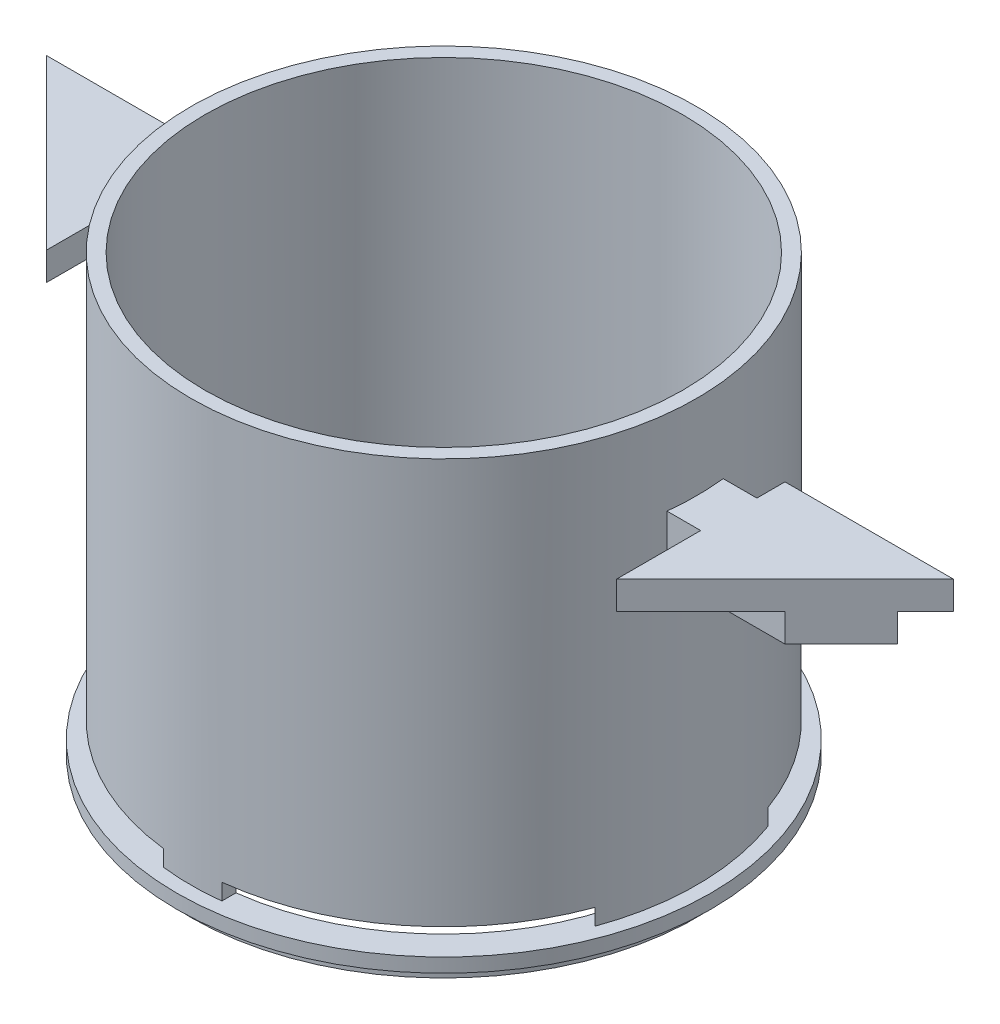
from build123d import *

# Parameters (mm, degrees)
SKETCH1_R               = 57.15
BOSS_EXTRUDE1_DEPTH     = 101.6
SKETCH2_R               = 53.975
CUT_EXTRUDE1_DEPTH      = 130.826056707
CUT_EXTRUDE4_DEPTH      = 130.826056707
CUT_EXTRUDE4_DEPTH_BACK = 130.826056707
SKETCH6_W               = 47.117
SKETCH6_H               = 3.683
BOSS_EXTRUDE7_START     = 3.175
SKETCH10_R              = 60.325
SKETCH10_R_2            = 57.15
BOSS_EXTRUDE7_DEPTH     = 3.175
BOSS_EXTRUDE6_START     = 12.7
BOSS_EXTRUDE6_DEPTH     = 12.7
BOSS_EXTRUDE8_DEPTH     = 6.35


with BuildPart() as part:
    # Sketch1 → Boss-Extrude1 (new body)
    with BuildSketch(Plane(origin=(0, 0, 0), x_dir=(1, 0, 0), z_dir=(0, 1, 0))):
        with Locations(Location((0, 0, 0), (0, 0, 270))):
            Circle(SKETCH1_R)
    extrude(amount=BOSS_EXTRUDE1_DEPTH)

    # Sketch2 → Cut-Extrude1 (cut, through all)
    with BuildSketch(Plane(origin=(0, 101.6, 0), x_dir=(1, 0, 0), z_dir=(0, 1, 0))):
        with Locations(Location((0, 0, 0), (0, 0, 270))):
            Circle(SKETCH2_R)
    extrude(amount=-CUT_EXTRUDE1_DEPTH, mode=Mode.SUBTRACT)

    # Sketch6 → Cut-Extrude4 (cut, two sides: drawn at the far end of the back side and taken through both)
    with BuildSketch(Plane.XY.offset(-CUT_EXTRUDE4_DEPTH_BACK)):
        with Locations((-30.1625, 8.1915)):
            Rectangle(SKETCH6_W, SKETCH6_H)
        with Locations((30.1625, 8.1915)):
            Rectangle(SKETCH6_W, SKETCH6_H)
    extrude(amount=CUT_EXTRUDE4_DEPTH + CUT_EXTRUDE4_DEPTH_BACK, mode=Mode.SUBTRACT)

    # Sketch10 → Boss-Extrude7 (add)
    with BuildSketch(Plane(origin=(0, 0, 0), x_dir=(1, 0, 0), z_dir=(0, 1, 0)).offset(BOSS_EXTRUDE7_START)):
        with Locations(Location((0, 0, 0), (0, 0, 270))):
            Circle(SKETCH10_R)
        with Locations(Location((0, 0, 0), (0, 0, 270))):
            Circle(SKETCH10_R_2, mode=Mode.SUBTRACT)
    extrude(amount=BOSS_EXTRUDE7_DEPTH)

    # Sketch9 → Boss-Extrude6 (add)
    with BuildSketch(Plane(origin=(0, 69.85, 0), x_dir=(1, 0, 0), z_dir=(0, 1, 0)).offset(BOSS_EXTRUDE6_START)):
        with BuildLine():
            Line((-83.4525636, -6.35), (-53.600169076, -6.35))
            ThreePointArc((-53.600169076, -6.35), (-53.975, 0), (-53.600169076, 6.35))
            Line((-53.600169076, 6.35), (-96.1525636, 6.35))
            Line((-96.1525636, 6.35), (-83.4525636, -6.35))
        make_face()
    boss_extrude6 = extrude(amount=-BOSS_EXTRUDE6_DEPTH)

    # Sketch11 → Boss-Extrude8 (add)
    with BuildSketch(Plane(origin=(0, 82.55, 0), x_dir=(1, 0, 0), z_dir=(0, 1, 0))):
        Polygon((-64.4025636, -25.4), (-64.4025636, 12.7), (-102.5025636, 12.7), align=None)
    boss_extrude8 = extrude(amount=-BOSS_EXTRUDE8_DEPTH)

    # Mirror1: Boss-Extrude6, Boss-Extrude8 across plane
    add(boss_extrude6.mirror(Plane(origin=(0, 0, 0), x_dir=(0, 0, 1), z_dir=(1, 0, 0))))
    add(boss_extrude8.mirror(Plane(origin=(0, 0, 0), x_dir=(0, 0, 1), z_dir=(1, 0, 0))))


solid = part.part
